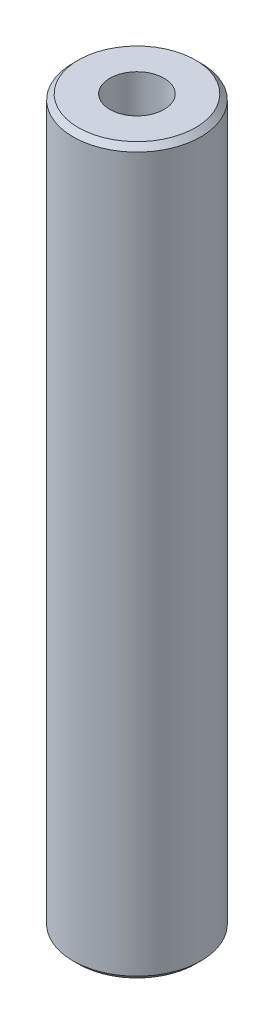
from build123d import *

# Parameters (mm, degrees)
CROQUIS2_R              = 4.7625
SALIENTE_EXTRUIR1_DEPTH = 26.9875
CHAFL_N1_SIZE           = 0.396875
TAP_START               = 26.9875
CROQUIS3_R              = 2.0193
TAP_HOLE_1_DEPTH        = 19.05
TAP_START_2             = -7.9375
CROQUIS3_2_R            = 2.0193
TAP_HOLE_2_DEPTH        = 19.05


with BuildPart() as part:
    # Croquis2 → Saliente-Extruir1 (new, symmetric)
    with BuildSketch(Plane(origin=(0, 0, 0), x_dir=(1, 0, 0), z_dir=(0, 1, 0))):
        with Locations(Location((0, 0, 0), (0, 0, 270))):
            Circle(CROQUIS2_R)
    extrude(amount=SALIENTE_EXTRUIR1_DEPTH, both=True)

    # Chaflán1
    chafl_n1_edges = [part.edges().sort_by_distance(p)[0] for p in [
        (0, -26.9875, -4.7625),
        (0, 26.9875, -4.7625),
    ]]
    chamfer(chafl_n1_edges, length=CHAFL_N1_SIZE)

    # Croquis3 → Tap Hole 1 (cut)
    with BuildSketch(Plane(origin=(0, 0, 0), x_dir=(1, 0, 0), z_dir=(0, 1, 0)).offset(TAP_START)):
        with Locations(Location((0, 0, 0), (0, 0, 270))):
            Circle(CROQUIS3_R)
    extrude(amount=-TAP_HOLE_1_DEPTH, mode=Mode.SUBTRACT)

    # Croquis3<2> → Tap Hole 2 (cut)
    with BuildSketch(Plane(origin=(0, 0, 0), x_dir=(1, 0, 0), z_dir=(0, 1, 0)).offset(TAP_START_2)):
        with Locations(Location((0, 0, 0), (0, 0, 270))):
            Circle(CROQUIS3_2_R)
    extrude(amount=-TAP_HOLE_2_DEPTH, mode=Mode.SUBTRACT)


solid = part.part
